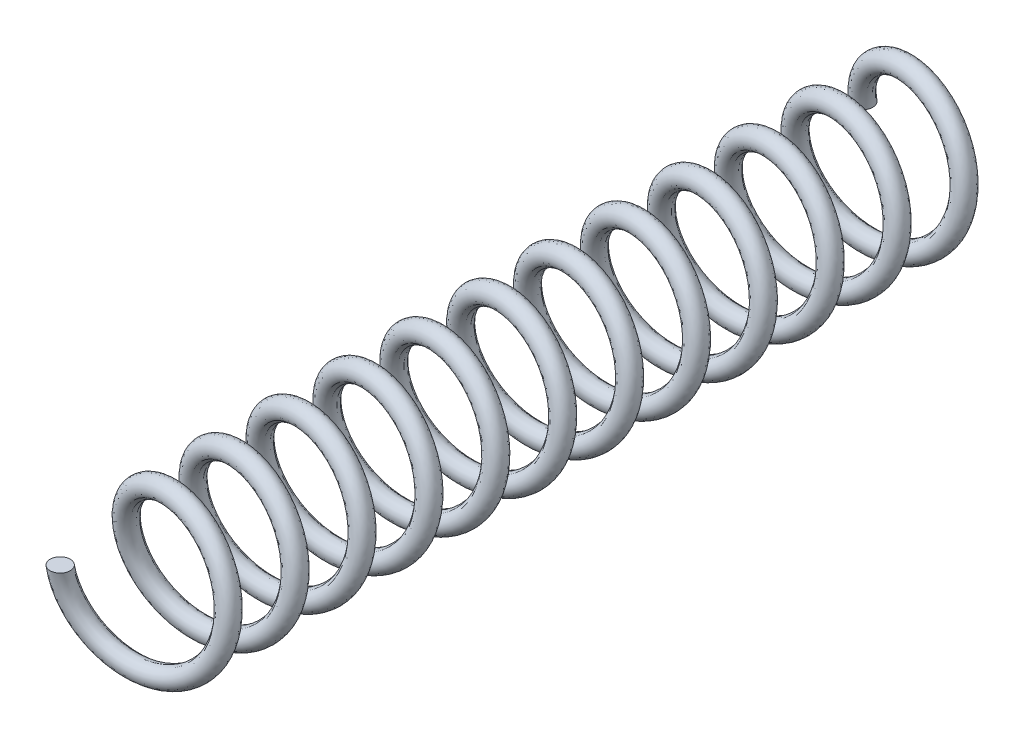
from build123d import *

# Parameters (mm, degrees)
SWEEP1_PITCH       = 5
SWEEP1_HEIGHT      = 60
SWEEP1_RADIUS      = 5
SWEEP1_START_ANGLE = -180
SKETCH2_R          = 0.75


with BuildPart() as part:
    # Sweep1: sweep along a helix
    with BuildLine() as sweep1_path:
        add(Helix(SWEEP1_PITCH, SWEEP1_HEIGHT, SWEEP1_RADIUS, center=(0, 0, 0), direction=(0, 0, 1), lefthand=True, mode=Mode.PRIVATE).rotate(Axis((0, 0, 0), (0, 0, 1)), SWEEP1_START_ANGLE))
    # Sketch2 → Sweep1 (sweep)
    with BuildSketch(Plane(origin=(0, 0, 0), x_dir=(1, 0, 0), z_dir=(0, 1, 0))):
        with Locations((-5, 0)):
            Circle(SKETCH2_R)
    sweep(path=sweep1_path.line, is_frenet=True)


solid = part.part
